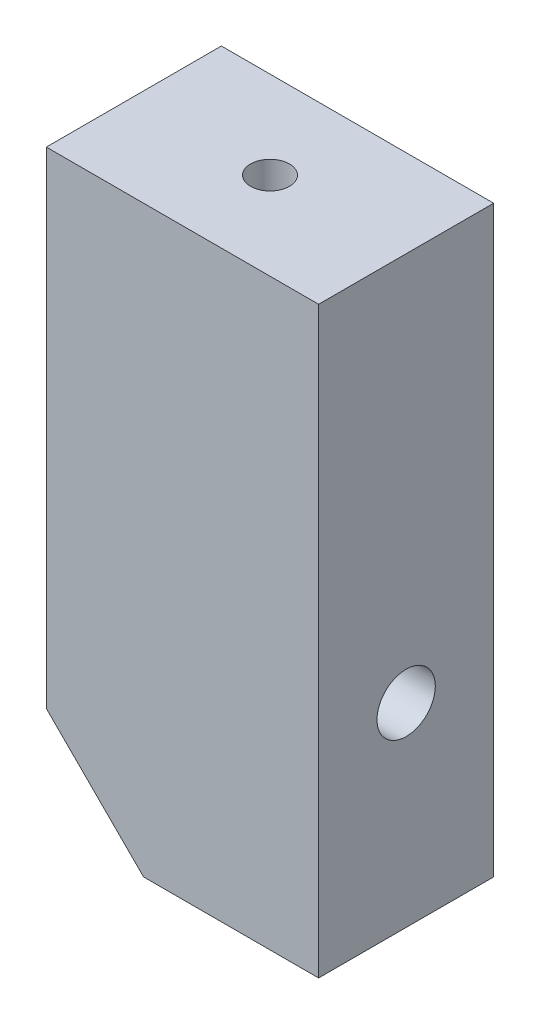
from build123d import *

# Parameters (mm, degrees)
SKETCH1_W                    = 28
SKETCH1_H                    = 60
BOSS_EXTRUDE1_DEPTH          = 18
CHAMFER1_SIZE                = 10
F_4_0_4_DIAMETER_HOLE1_D     = 4
F_4_0_4_DIAMETER_HOLE1_DEPTH = 30
F_4_0_4_DIAMETER_HOLE1_TIP   = 1.201721238
F_6_0_6_DIAMETER_HOLE2_D     = 6
F_6_0_6_DIAMETER_HOLE2_DEPTH = 18


with BuildPart() as part:
    # Sketch1 → Boss-Extrude1 (new body)
    with BuildSketch(Plane.XY):
        Rectangle(SKETCH1_W, SKETCH1_H)
    extrude(amount=BOSS_EXTRUDE1_DEPTH)

    # Chamfer1
    chamfer1_edges = [part.edges().sort_by_distance(p)[0] for p in [
        (-14, -30, 9),
    ]]
    chamfer(chamfer1_edges, length=CHAMFER1_SIZE)

    # Ø4.0 (4) Diameter Hole1
    with Locations(Plane(origin=(0, 30, 0), x_dir=(1, 0, 0), z_dir=(0, 1, 0))):
        with Locations((0, -9)):
            Hole(F_4_0_4_DIAMETER_HOLE1_D / 2, depth=F_4_0_4_DIAMETER_HOLE1_DEPTH)
            with Locations((0, 0, -(F_4_0_4_DIAMETER_HOLE1_DEPTH + F_4_0_4_DIAMETER_HOLE1_TIP / 2))):  # 118° drill point
                Cone(0, F_4_0_4_DIAMETER_HOLE1_D / 2, F_4_0_4_DIAMETER_HOLE1_TIP, mode=Mode.SUBTRACT)

    # Ø6.0 (6) Diameter Hole2
    with Locations(Plane(origin=(14, 0, 0), x_dir=(0, 0, -1), z_dir=(1, 0, 0))):
        with Locations((-9, -10)):
            Hole(F_6_0_6_DIAMETER_HOLE2_D / 2, depth=F_6_0_6_DIAMETER_HOLE2_DEPTH)


solid = part.part
